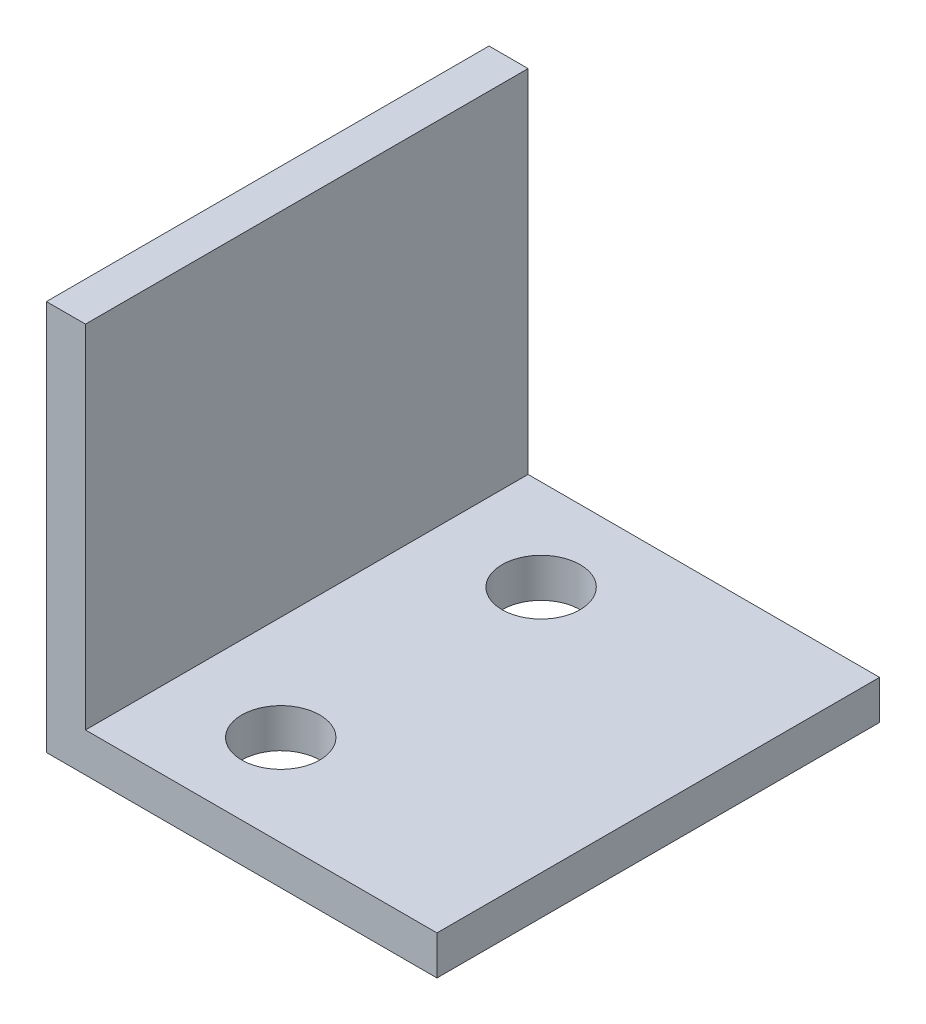
from build123d import *

# Parameters (mm, degrees)
EXTRUSION1_DEPTH = 17
ESQUISSE2_R      = 1.5
EXTRUSION2_DEPTH = 15


with BuildPart() as part:
    # Esquisse1 → Extrusion1 (new body)
    with BuildSketch(Plane.XY):
        Polygon((-21.976949538, -4.544631579), (-21.976949538, -19.544631579), (-6.976949538, -19.544631579), (-6.976949538, -18.044631579), (-20.476949538, -18.044631579), (-20.476949538, -4.544631579), align=None)
    extrude(amount=EXTRUSION1_DEPTH)

    # Esquisse2 → Extrusion2 (cut)
    with BuildSketch(Plane(origin=(0, -18.044631579, 0), x_dir=(1, 0, 0), z_dir=(0, 1, 0))):
        with Locations(Location((-16.476949538, -13.5, 0), (0, 0, 180))):
            Circle(ESQUISSE2_R)
        with Locations(Location((-16.476949538, -3.5, 0), (0, 0, 180))):
            Circle(ESQUISSE2_R)
    extrude(amount=-EXTRUSION2_DEPTH, mode=Mode.SUBTRACT)


solid = part.part
